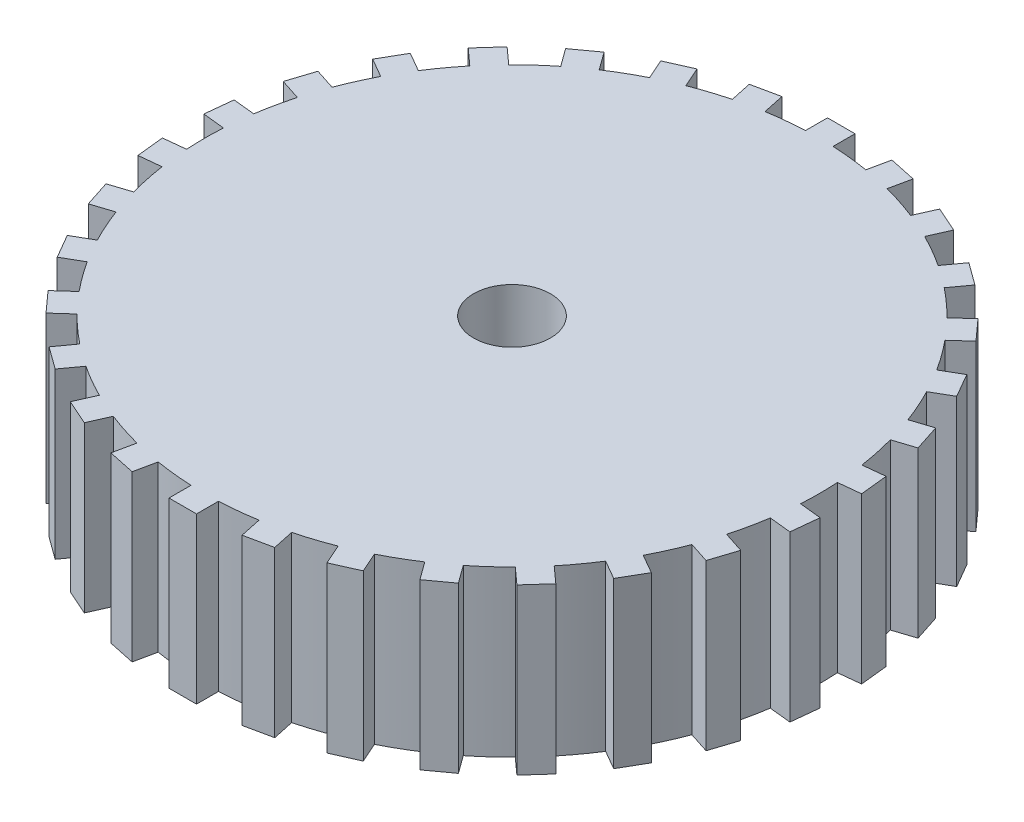
from build123d import *

# Parameters (mm, degrees)
SALIENTE_EXTRUIR1_DEPTH = 15
CROQUIS3_R              = 18
SALIENTE_EXTRUIR2_DEPTH = 0.5
CROQUIS4_R              = 3.5
CORTAR_EXTRUIR1_DEPTH   = 24.5
CROQUIS5_R              = 10
CORTAR_EXTRUIR2_DEPTH   = 0.5
CORTAR_EXTRUIR3_START   = -0.3
CROQUIS6_R              = 26.676513241
CROQUIS6_R_2            = 18
CORTAR_EXTRUIR3_DEPTH   = 0.3


with BuildPart() as part:
    # Croquis2 → Saliente-Extruir1 (new body)
    with BuildSketch(Plane(origin=(0, 0, 0), x_dir=(1, 0, 0), z_dir=(0, 1, 0))):
        with BuildLine():
            Line((-1.253633745, 27.971921679), (-1.253633745, 29.973795262))
            Line((-1.253633745, 29.973795262), (1.253633745, 29.973795262))
            Line((1.253633745, 29.973795262), (1.253633745, 27.971921679))
            ThreePointArc((1.253633745, 27.971921679), (2.926796971, 27.84661307), (4.589450692, 27.62131319))
            Line((4.589450692, 27.62131319), (5.005663613, 29.579441032))
            Line((5.005663613, 29.579441032), (7.458141293, 29.058150809))
            Line((7.458141293, 29.058150809), (7.041928372, 27.100022967))
            ThreePointArc((7.041928372, 27.100022967), (8.652475842, 26.629582456), (10.231954111, 26.063520773))
            Line((10.231954111, 26.063520773), (11.046189452, 27.892323292))
            Line((11.046189452, 27.892323292), (13.336692279, 26.872525729))
            Line((13.336692279, 26.872525729), (12.522456938, 25.04372321))
            ThreePointArc((12.522456938, 25.04372321), (14, 24.248711306), (15.427272037, 23.366627431))
            Line((15.427272037, 23.366627431), (16.603943806, 24.98617718))
            Line((16.603943806, 24.98617718), (18.632365815, 23.512442326))
            Line((18.632365815, 23.512442326), (17.455694046, 21.892892577))
            ThreePointArc((17.455694046, 21.892892577), (18.735656978, 20.808055113), (19.948344146, 19.648500345))
            Line((19.948344146, 19.648500345), (21.436026141, 20.98801523))
            Line((21.436026141, 20.98801523), (23.113715557, 19.124752368))
            Line((23.113715557, 19.124752368), (21.626033563, 17.785237483))
            ThreePointArc((21.626033563, 17.785237483), (22.652475842, 16.457987064), (23.597577894, 15.07163951))
            Line((23.597577894, 15.07163951), (25.331251272, 16.072576302))
            Line((25.331251272, 16.072576302), (26.584885018, 13.901218961))
            Line((26.584885018, 13.901218961), (24.85121164, 12.900282169))
            ThreePointArc((24.85121164, 12.900282169), (25.579272814, 11.388626006), (26.215484254, 9.836075707))
            Line((26.215484254, 9.836075707), (28.11937917, 10.454688665))
            Line((28.11937917, 10.454688665), (28.894167434, 8.070135579))
            Line((28.894167434, 8.070135579), (26.990272518, 7.451522622))
            ThreePointArc((26.990272518, 7.451522622), (27.388132821, 5.821527343), (27.687648157, 4.170628196))
            Line((27.687648157, 4.170628196), (29.678555267, 4.379880966))
            Line((29.678555267, 4.379880966), (29.940636085, 1.886348549))
            Line((29.940636085, 1.886348549), (27.949728974, 1.677095779))
            ThreePointArc((27.949728974, 1.677095779), (28, 0), (27.949728974, -1.677095779))
            Line((27.949728974, -1.677095779), (29.940636085, -1.886348549))
            Line((29.940636085, -1.886348549), (29.678555267, -4.379880966))
            Line((29.678555267, -4.379880966), (27.687648157, -4.170628196))
            ThreePointArc((27.687648157, -4.170628196), (27.388132821, -5.821527343), (26.990272518, -7.451522622))
            Line((26.990272518, -7.451522622), (28.894167434, -8.070135579))
            Line((28.894167434, -8.070135579), (28.11937917, -10.454688665))
            Line((28.11937917, -10.454688665), (26.215484254, -9.836075707))
            ThreePointArc((26.215484254, -9.836075707), (25.579272814, -11.388626006), (24.85121164, -12.900282169))
            Line((24.85121164, -12.900282169), (26.584885018, -13.901218961))
            Line((26.584885018, -13.901218961), (25.331251272, -16.072576302))
            Line((25.331251272, -16.072576302), (23.597577894, -15.07163951))
            ThreePointArc((23.597577894, -15.07163951), (22.652475842, -16.457987064), (21.626033563, -17.785237483))
            Line((21.626033563, -17.785237483), (23.113715557, -19.124752368))
            Line((23.113715557, -19.124752368), (21.436026141, -20.98801523))
            Line((21.436026141, -20.98801523), (19.948344146, -19.648500345))
            ThreePointArc((19.948344146, -19.648500345), (18.735656978, -20.808055113), (17.455694046, -21.892892577))
            Line((17.455694046, -21.892892577), (18.632365815, -23.512442326))
            Line((18.632365815, -23.512442326), (16.603943806, -24.98617718))
            Line((16.603943806, -24.98617718), (15.427272037, -23.366627431))
            ThreePointArc((15.427272037, -23.366627431), (14, -24.248711306), (12.522456938, -25.04372321))
            Line((12.522456938, -25.04372321), (13.336692279, -26.872525729))
            Line((13.336692279, -26.872525729), (11.046189452, -27.892323292))
            Line((11.046189452, -27.892323292), (10.231954111, -26.063520773))
            ThreePointArc((10.231954111, -26.063520773), (8.652475842, -26.629582456), (7.041928372, -27.100022967))
            Line((7.041928372, -27.100022967), (7.458141293, -29.058150809))
            Line((7.458141293, -29.058150809), (5.005663613, -29.579441032))
            Line((5.005663613, -29.579441032), (4.589450692, -27.62131319))
            ThreePointArc((4.589450692, -27.62131319), (2.926796971, -27.84661307), (1.253633745, -27.971921679))
            Line((1.253633745, -27.971921679), (1.253633745, -29.973795262))
            Line((1.253633745, -29.973795262), (-1.253633745, -29.973795262))
            Line((-1.253633745, -29.973795262), (-1.253633745, -27.971921679))
            ThreePointArc((-1.253633745, -27.971921679), (-2.926796971, -27.84661307), (-4.589450692, -27.62131319))
            Line((-4.589450692, -27.62131319), (-5.005663613, -29.579441032))
            Line((-5.005663613, -29.579441032), (-7.458141293, -29.058150809))
            Line((-7.458141293, -29.058150809), (-7.041928372, -27.100022967))
            ThreePointArc((-7.041928372, -27.100022967), (-8.652475842, -26.629582456), (-10.231954111, -26.063520773))
            Line((-10.231954111, -26.063520773), (-11.046189452, -27.892323292))
            Line((-11.046189452, -27.892323292), (-13.336692279, -26.872525729))
            Line((-13.336692279, -26.872525729), (-12.522456938, -25.04372321))
            ThreePointArc((-12.522456938, -25.04372321), (-14, -24.248711306), (-15.427272037, -23.366627431))
            Line((-15.427272037, -23.366627431), (-16.603943806, -24.98617718))
            Line((-16.603943806, -24.98617718), (-18.632365815, -23.512442326))
            Line((-18.632365815, -23.512442326), (-17.455694046, -21.892892577))
            ThreePointArc((-17.455694046, -21.892892577), (-18.735656978, -20.808055113), (-19.948344146, -19.648500345))
            Line((-19.948344146, -19.648500345), (-21.436026141, -20.98801523))
            Line((-21.436026141, -20.98801523), (-23.113715557, -19.124752368))
            Line((-23.113715557, -19.124752368), (-21.626033563, -17.785237483))
            ThreePointArc((-21.626033563, -17.785237483), (-22.652475842, -16.457987064), (-23.597577894, -15.07163951))
            Line((-23.597577894, -15.07163951), (-25.331251272, -16.072576302))
            Line((-25.331251272, -16.072576302), (-26.584885018, -13.901218961))
            Line((-26.584885018, -13.901218961), (-24.85121164, -12.900282169))
            ThreePointArc((-24.85121164, -12.900282169), (-25.579272814, -11.388626006), (-26.215484254, -9.836075707))
            Line((-26.215484254, -9.836075707), (-28.11937917, -10.454688665))
            Line((-28.11937917, -10.454688665), (-28.894167434, -8.070135579))
            Line((-28.894167434, -8.070135579), (-26.990272518, -7.451522622))
            ThreePointArc((-26.990272518, -7.451522622), (-27.388132821, -5.821527343), (-27.687648157, -4.170628196))
            Line((-27.687648157, -4.170628196), (-29.678555267, -4.379880966))
            Line((-29.678555267, -4.379880966), (-29.940636085, -1.886348549))
            Line((-29.940636085, -1.886348549), (-27.949728974, -1.677095779))
            ThreePointArc((-27.949728974, -1.677095779), (-28, 0), (-27.949728974, 1.677095779))
            Line((-27.949728974, 1.677095779), (-29.940636085, 1.886348549))
            Line((-29.940636085, 1.886348549), (-29.678555267, 4.379880966))
            Line((-29.678555267, 4.379880966), (-27.687648157, 4.170628196))
            ThreePointArc((-27.687648157, 4.170628196), (-27.388132821, 5.821527343), (-26.990272518, 7.451522622))
            Line((-26.990272518, 7.451522622), (-28.894167434, 8.070135579))
            Line((-28.894167434, 8.070135579), (-28.11937917, 10.454688665))
            Line((-28.11937917, 10.454688665), (-26.215484254, 9.836075707))
            ThreePointArc((-26.215484254, 9.836075707), (-25.579272814, 11.388626006), (-24.85121164, 12.900282169))
            Line((-24.85121164, 12.900282169), (-26.584885018, 13.901218961))
            Line((-26.584885018, 13.901218961), (-25.331251272, 16.072576302))
            Line((-25.331251272, 16.072576302), (-23.597577894, 15.07163951))
            ThreePointArc((-23.597577894, 15.07163951), (-22.652475842, 16.457987064), (-21.626033563, 17.785237483))
            Line((-21.626033563, 17.785237483), (-23.113715557, 19.124752368))
            Line((-23.113715557, 19.124752368), (-21.436026141, 20.98801523))
            Line((-21.436026141, 20.98801523), (-19.948344146, 19.648500345))
            ThreePointArc((-19.948344146, 19.648500345), (-18.735656978, 20.808055113), (-17.455694046, 21.892892577))
            Line((-17.455694046, 21.892892577), (-18.632365815, 23.512442326))
            Line((-18.632365815, 23.512442326), (-16.603943806, 24.98617718))
            Line((-16.603943806, 24.98617718), (-15.427272037, 23.366627431))
            ThreePointArc((-15.427272037, 23.366627431), (-14, 24.248711306), (-12.522456938, 25.04372321))
            Line((-12.522456938, 25.04372321), (-13.336692279, 26.872525729))
            Line((-13.336692279, 26.872525729), (-11.046189452, 27.892323292))
            Line((-11.046189452, 27.892323292), (-10.231954111, 26.063520773))
            ThreePointArc((-10.231954111, 26.063520773), (-8.652475842, 26.629582456), (-7.041928372, 27.100022967))
            Line((-7.041928372, 27.100022967), (-7.458141293, 29.058150809))
            Line((-7.458141293, 29.058150809), (-5.005663613, 29.579441032))
            Line((-5.005663613, 29.579441032), (-4.589450692, 27.62131319))
            ThreePointArc((-4.589450692, 27.62131319), (-2.926796971, 27.84661307), (-1.253633745, 27.971921679))
        make_face()
    extrude(amount=SALIENTE_EXTRUIR1_DEPTH)

    # Croquis3 → Saliente-Extruir2 (add)
    with BuildSketch(Plane.XZ):
        with Locations(Location((0, 0, 0), (0, 0, 90))):
            Circle(CROQUIS3_R)
    extrude(amount=SALIENTE_EXTRUIR2_DEPTH)

    # Croquis4 → Cortar-Extruir1 (cut)
    with BuildSketch(Plane.XZ.offset(0.5)):
        with Locations(Location((0, 0, 0), (0, 0, 270))):
            Circle(CROQUIS4_R)
    extrude(amount=-CORTAR_EXTRUIR1_DEPTH, mode=Mode.SUBTRACT)

    # Croquis5 → Cortar-Extruir2 (cut)
    with BuildSketch(Plane(origin=(0, -0.5, 0), x_dir=(-1, 0, 0), z_dir=(0, -1, 0))):
        with Locations(Location((0, 0, 0), (0, 0, 90))):
            Circle(CROQUIS5_R)
    extrude(amount=-CORTAR_EXTRUIR2_DEPTH, mode=Mode.SUBTRACT)

    # Croquis6 → Cortar-Extruir3 (cut)
    with BuildSketch(Plane.XZ.offset(CORTAR_EXTRUIR3_START)):
        with Locations(Location((0, 0, 0), (0, 0, 270))):
            Circle(CROQUIS6_R)
        with Locations(Location((0, 0, 0), (0, 0, 270))):
            Circle(CROQUIS6_R_2, mode=Mode.SUBTRACT)
    extrude(amount=CORTAR_EXTRUIR3_DEPTH, mode=Mode.SUBTRACT)


solid = part.part
